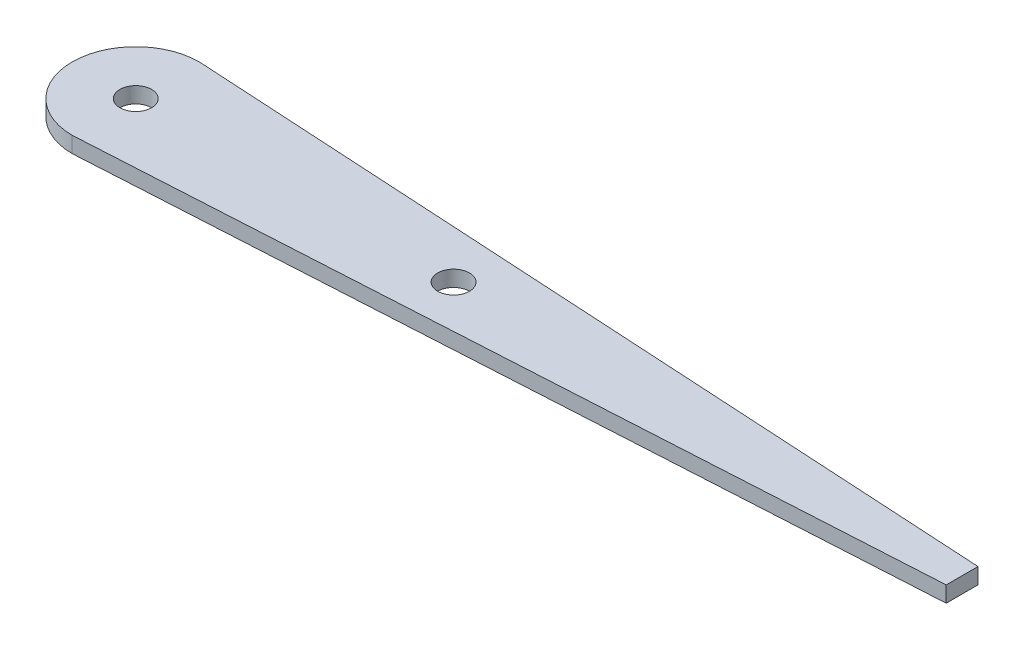
from build123d import *

# Parameters (mm, degrees)
SKETCH2_R           = 1.5875
BOSS_EXTRUDE1_DEPTH = 1.5875


with BuildPart() as part:
    # Sketch2 → Boss-Extrude1 (new body)
    with BuildSketch(Plane(origin=(0, 0, 0), x_dir=(1, 0, 0), z_dir=(0, 1, 0))):
        with BuildLine():
            Line((-31.75, -6.35), (50.8, -1.5875))
            Line((50.8, -1.5875), (50.8, 1.5875))
            Line((50.8, 1.5875), (-31.75, 6.35))
            ThreePointArc((-31.75, 6.35), (-38.1, 0), (-31.75, -6.35))
        make_face()
        with Locations(Location((0, 0, 0), (0, 0, 270))):
            Circle(SKETCH2_R, mode=Mode.SUBTRACT)
        with Locations(Location((-31.75, 0, 0), (0, 0, 270))):
            Circle(SKETCH2_R, mode=Mode.SUBTRACT)
    extrude(amount=BOSS_EXTRUDE1_DEPTH)


solid = part.part
